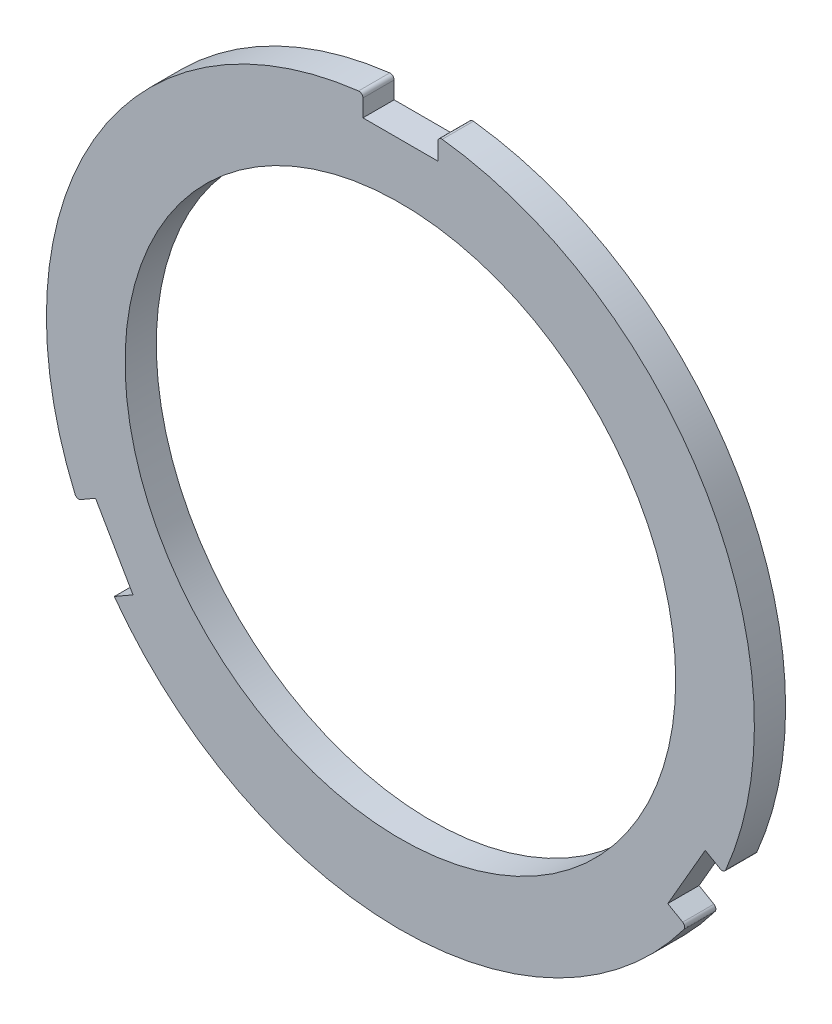
from build123d import *

# Parameters (mm, degrees)
SKETCH1_R           = 17.5
BOSS_EXTRUDE1_DEPTH = 1.984375
FILLET1_R           = 0.25


with BuildPart() as part:
    # Sketch1 → Boss-Extrude1 (new body)
    with BuildSketch(Plane.XY):
        with BuildLine():
            Line((0, 21), (2.38125, 21))
            Line((2.38125, 21), (2.38125, 22.373637354))
            ThreePointArc((2.38125, 22.373637354), (19.485571585, 11.25), (20.566763323, -9.124595684))
            Line((20.566763323, -9.124595684), (19.377158479, -8.437777007))
            Line((19.377158479, -8.437777007), (18.186533479, -10.5))
            Line((18.186533479, -10.5), (16.995908479, -12.562222993))
            Line((16.995908479, -12.562222993), (18.185513323, -13.24904167))
            ThreePointArc((18.185513323, -13.24904167), (0, -22.5), (-18.185513323, -13.24904167))
            Line((-18.185513323, -13.24904167), (-16.995908479, -12.562222993))
            Line((-16.995908479, -12.562222993), (-18.186533479, -10.5))
            Line((-18.186533479, -10.5), (-19.377158479, -8.437777007))
            Line((-19.377158479, -8.437777007), (-20.566763323, -9.124595684))
            ThreePointArc((-20.566763323, -9.124595684), (-19.485571585, 11.25), (-2.38125, 22.373637354))
            Line((-2.38125, 22.373637354), (-2.38125, 21))
            Line((-2.38125, 21), (0, 21))
        make_face()
        Circle(SKETCH1_R, mode=Mode.SUBTRACT)
    extrude(amount=BOSS_EXTRUDE1_DEPTH)

    # Fillet1
    fillet1_edges = [part.edges().sort_by_distance(p)[0] for p in [
        (-17.590710901, -12.905632331, 0),
        (2.38125, 22.373637354, 0.9921875),
        (20.566763323, -9.124595684, 0.9921875),
        (18.185513323, -13.24904167, 0.9921875),
        (-20.566763323, -9.124595684, 0.9921875),
        (-2.38125, 22.373637354, 0.9921875),
    ]]
    fillet(fillet1_edges, radius=FILLET1_R)


solid = part.part
